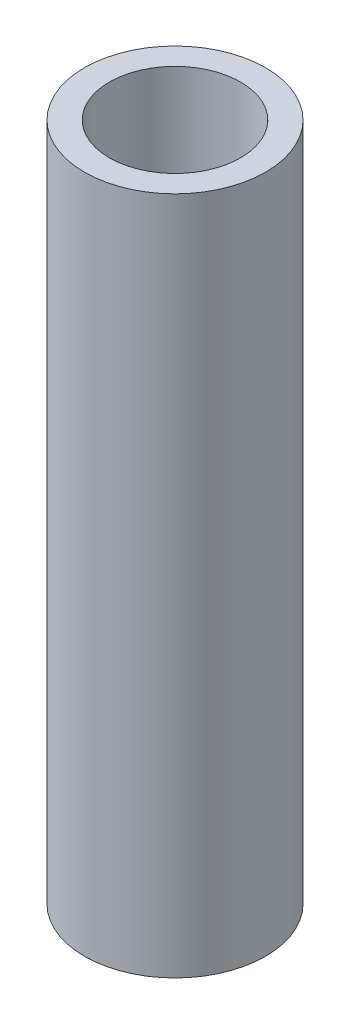
from build123d import *

# Parameters (mm, degrees)
SKETCH_1_R      = 8
SKETCH_1_R_2    = 5.8
EXTRUDE_1_DEPTH = 60


with BuildPart() as part:
    # Эскиз1 → Бобышка-Вытянуть1 (new body)
    with BuildSketch(Plane(origin=(0, 0, 0), x_dir=(1, 0, 0), z_dir=(0, 1, 0))):
        with Locations(Location((0, 0, 0), (0, 0, 270))):
            Circle(SKETCH_1_R)
        with Locations(Location((0, 0, 0), (0, 0, 270))):
            Circle(SKETCH_1_R_2, mode=Mode.SUBTRACT)
    extrude(amount=EXTRUDE_1_DEPTH)


solid = part.part
